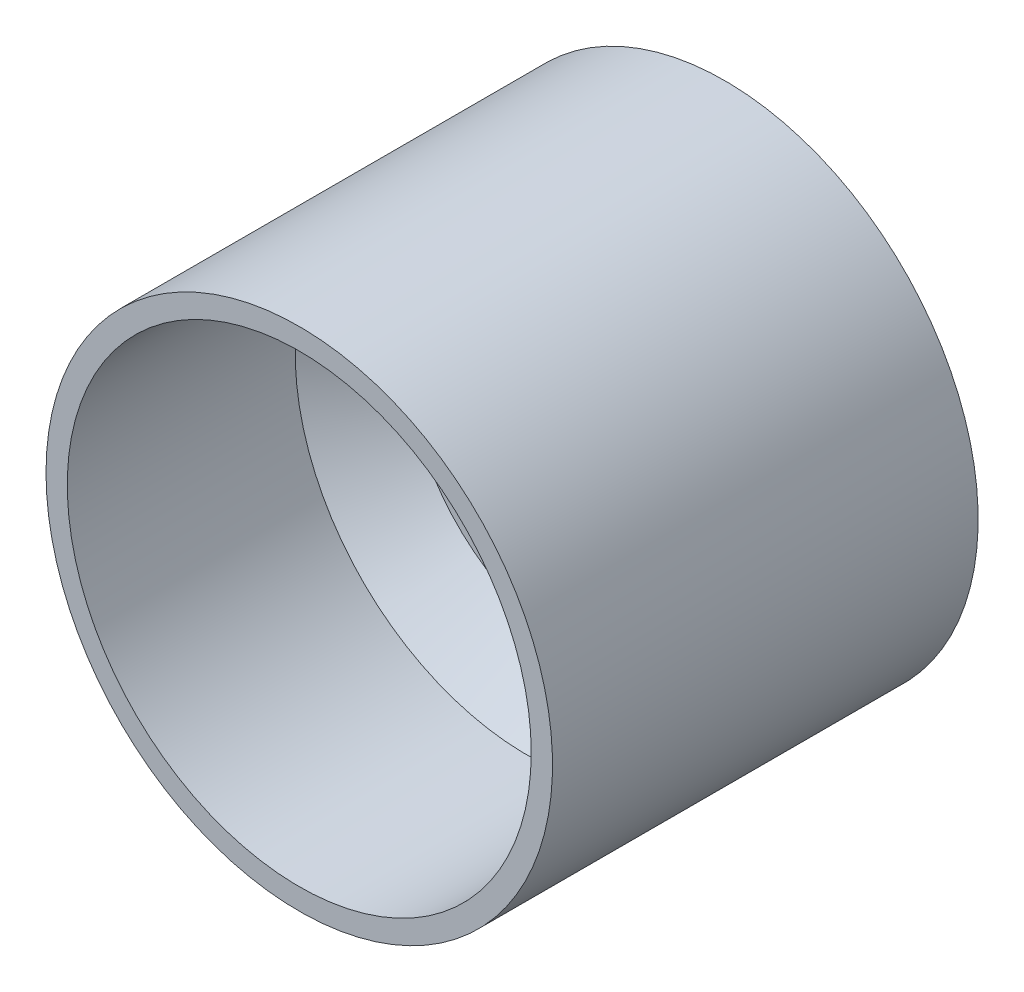
from build123d import *

# Parameters (mm, degrees)
SKETCH1_R           = 45.339
BOSS_EXTRUDE2_DEPTH = 38.1
SKETCH3_R           = 41.529
CUT_EXTRUDE1_DEPTH  = 50.8
SKETCH4_R           = 20.0025
CUT_EXTRUDE2_DEPTH  = 25.4
CHAMFER1_SIZE       = 10


with BuildPart() as part:
    # Sketch1 → Boss-Extrude2 (new, symmetric)
    with BuildSketch(Plane(origin=(0, 0, 0), x_dir=(0, 1, 0), z_dir=(0, 0, 1))):
        with Locations(Location((0, 0, 0), (0, 0, 90))):
            Circle(SKETCH1_R)
    extrude(amount=BOSS_EXTRUDE2_DEPTH, both=True)

    # Sketch3 → Cut-Extrude1 (cut)
    with BuildSketch(Plane.XY.offset(38.1)):
        Circle(SKETCH3_R)
    extrude(amount=-CUT_EXTRUDE1_DEPTH, mode=Mode.SUBTRACT)

    # Sketch4 → Cut-Extrude2 (cut)
    with BuildSketch(Plane(origin=(0, 0, -38.1), x_dir=(1, 0, 0), z_dir=(0, 0, -1))):
        with Locations(Location((0, 0, 0), (0, 0, 180))):
            Circle(SKETCH4_R)
    extrude(amount=-CUT_EXTRUDE2_DEPTH, mode=Mode.SUBTRACT)

    # Chamfer1
    chamfer1_edges = [part.edges().sort_by_distance(p)[0] for p in [
        (20.0025, 0, -12.7),
        (-41.529, 0, -12.7),
    ]]
    chamfer(chamfer1_edges, length=CHAMFER1_SIZE)


solid = part.part
